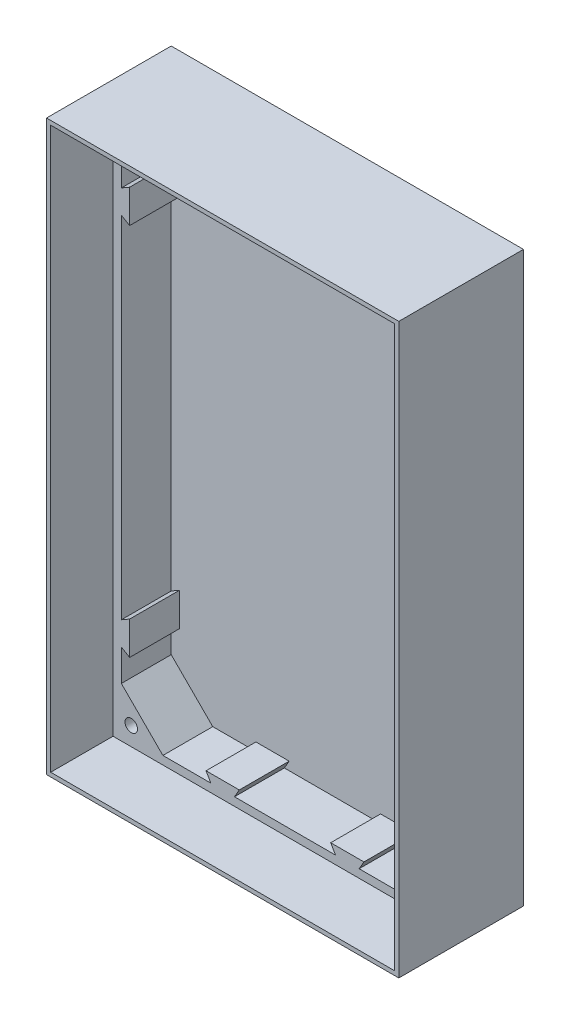
from build123d import *

# Parameters (mm, degrees)
CROQUIS2_W              = 136.848636308
CROQUIS2_H              = 84.76602742
SALIENTE_EXTRUIR1_DEPTH = 15
CORTAR_EXTRUIR1_START   = 15
CORTAR_EXTRUIR1_DEPTH   = 27
CROQUIS4_W              = 82.76602742
CROQUIS4_H              = 134.848636308
CORTAR_EXTRUIR2_DEPTH   = 15
CROQUIS6_R              = 1.5
CORTAR_EXTRUIR3_DEPTH   = 10


with BuildPart() as part:
    # Croquis2 → Saliente-Extruir1 (new, symmetric)
    with BuildSketch(Plane(origin=(0, 0, 0), x_dir=(0, 1, 0), z_dir=(0, 0, 1))):
        Rectangle(CROQUIS2_W, CROQUIS2_H)
    extrude(amount=SALIENTE_EXTRUIR1_DEPTH, both=True)

    # Croquis3 → Cortar-Extruir1 (cut)
    with BuildSketch(Plane(origin=(0, 0, 0), x_dir=(0, 1, 0), z_dir=(0, 0, 1)).offset(CORTAR_EXTRUIR1_START)):
        Polygon((-55.424318154, -39.38301371), (-47.845299462, -39.38301371), (-49, -41.38301371), (-41, -41.38301371), (-42.154700538, -39.38301371), (42.154700538, -39.38301371), (41, -41.38301371), (49, -41.38301371), (47.845299462, -39.38301371), (55.424318154, -39.38301371), (65.424318154, -29.38301371), (65.424318154, -17.845299462), (67.424318154, -19), (67.424318154, -11), (65.424318154, -12.154700538), (65.424318154, 12.154700538), (67.424318154, 11), (67.424318154, 19), (65.424318154, 17.845299462), (65.424318154, 29.38301371), (55.424318154, 39.38301371), (47.845299462, 39.38301371), (49, 37.38301371), (41, 37.38301371), (42.154700538, 39.38301371), (-42.154700538, 39.38301371), (-41, 37.38301371), (-49, 37.38301371), (-47.845299462, 39.38301371), (-55.424318154, 39.38301371), (-65.424318154, 29.38301371), (-65.424318154, 17.845299462), (-63.424318154, 19), (-63.424318154, 11), (-65.424318154, 12.154700538), (-65.424318154, -12.154700538), (-63.424318154, -11), (-63.424318154, -19), (-65.424318154, -17.845299462), (-65.424318154, -29.38301371), align=None)
    extrude(amount=-CORTAR_EXTRUIR1_DEPTH, mode=Mode.SUBTRACT)

    # Croquis4 → Cortar-Extruir2 (cut)
    with BuildSketch(Plane.XY.offset(15)):
        Rectangle(CROQUIS4_W, CROQUIS4_H)
    extrude(amount=-CORTAR_EXTRUIR2_DEPTH, mode=Mode.SUBTRACT)

    # Croquis6 → Cortar-Extruir3 (cut)
    with BuildSketch(Plane.XY):
        with Locations(Location((-37, 63, 0), (0, 0, 180))):
            Circle(CROQUIS6_R)
        with Locations(Location((37, 63, 0), (0, 0, 180))):
            Circle(CROQUIS6_R)
        with Locations(Location((37, -63, 0), (0, 0, 180))):
            Circle(CROQUIS6_R)
        with Locations(Location((-37, -63, 0), (0, 0, 180))):
            Circle(CROQUIS6_R)
    extrude(amount=-CORTAR_EXTRUIR3_DEPTH, mode=Mode.SUBTRACT)


solid = part.part
